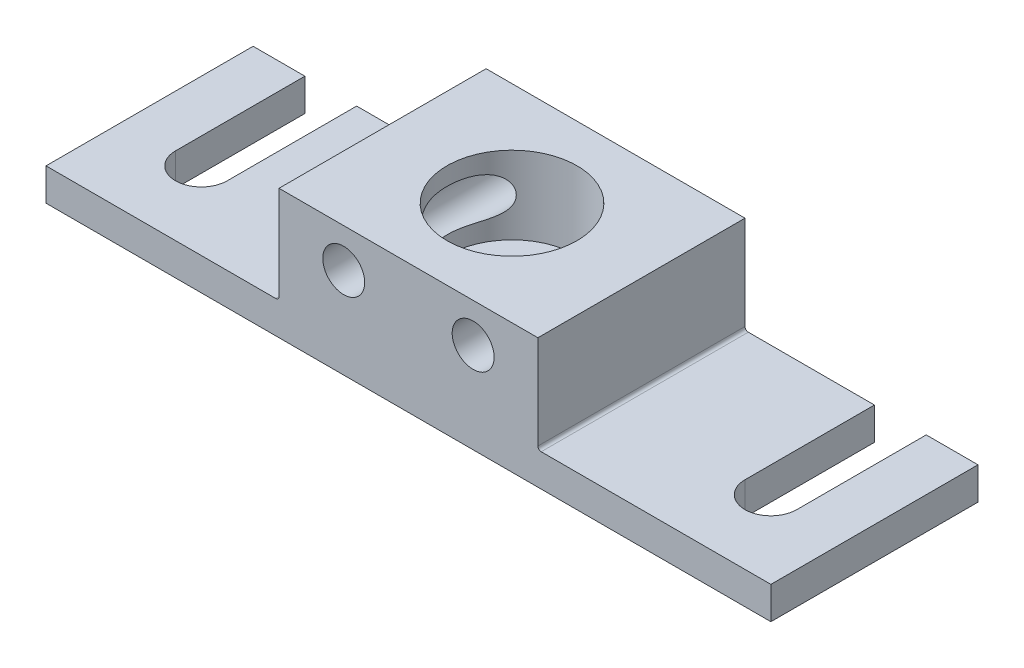
from build123d import *

# Parameters (mm, degrees)
SKETCH1_W           = 28
SKETCH1_H           = 8
BOSS_EXTRUDE1_DEPTH = 1.25
SKETCH2_W           = 10
SKETCH2_H           = 8
BOSS_EXTRUDE2_DEPTH = 3.75
SKETCH3_R           = 2.51
CUT_EXTRUDE1_DEPTH  = 3
SKETCH4_W           = 3
SKETCH4_H           = 2.3
CUT_EXTRUDE2_DEPTH  = 15.866068747
CUT_EXTRUDE4_DEPTH  = 16.035374954
SKETCH7_R           = 0.81
CUT_EXTRUDE5_DEPTH  = 17.881943016
FILLET1_R           = 0.5
FILLET2_R           = 0.127


with BuildPart() as part:
    # Sketch1 → Boss-Extrude1 (new body)
    with BuildSketch(Plane(origin=(0, 0, 0), x_dir=(1, 0, 0), z_dir=(0, 1, 0))):
        Rectangle(SKETCH1_W, SKETCH1_H)
    extrude(amount=BOSS_EXTRUDE1_DEPTH)

    # Sketch2 → Boss-Extrude2 (add)
    with BuildSketch(Plane(origin=(0, 1.25, 0), x_dir=(1, 0, 0), z_dir=(0, 1, 0))):
        Rectangle(SKETCH2_W, SKETCH2_H)
    extrude(amount=BOSS_EXTRUDE2_DEPTH)

    # Sketch3 → Cut-Extrude1 (cut)
    with BuildSketch(Plane(origin=(0, 5, 0), x_dir=(1, 0, 0), z_dir=(0, 1, 0))):
        with Locations(Location((0, 0, 0), (0, 0, 270))):
            Circle(SKETCH3_R)
    extrude(amount=-CUT_EXTRUDE1_DEPTH, mode=Mode.SUBTRACT)

    # Sketch4 → Cut-Extrude2 (cut, through all)
    with BuildSketch(Plane(origin=(0, 2, 0), x_dir=(1, 0, 0), z_dir=(0, 1, 0))):
        Rectangle(SKETCH4_W, SKETCH4_H)
    extrude(amount=-CUT_EXTRUDE2_DEPTH, mode=Mode.SUBTRACT)

    # Sketch6 → Cut-Extrude4 (cut, through all)
    with BuildSketch(Plane(origin=(0, 1.25, 0), x_dir=(1, 0, 0), z_dir=(0, 1, 0))):
        with BuildLine():
            Line((12, 4), (12, -1))
            ThreePointArc((12, -1), (11, -2), (10, -1))
            Line((10, -1), (10, 4))
            Line((10, 4), (12, 4))
        make_face()
        with BuildLine():
            Line((-12, 4), (-12, -1))
            ThreePointArc((-12, -1), (-11, -2), (-10, -1))
            Line((-10, -1), (-10, 4))
            Line((-10, 4), (-12, 4))
        make_face()
    extrude(amount=-CUT_EXTRUDE4_DEPTH, mode=Mode.SUBTRACT)

    # Sketch7 → Cut-Extrude5 (cut, through all)
    with BuildSketch(Plane(origin=(0, 0, -4), x_dir=(-1, 0, 0), z_dir=(0, 0, -1))):
        with Locations((2.5, 3.5)):
            Circle(SKETCH7_R)
    cut_extrude5 = extrude(amount=-CUT_EXTRUDE5_DEPTH, mode=Mode.SUBTRACT)

    # Mirror1: Cut-Extrude5 across plane
    add(cut_extrude5.mirror(Plane.ZY), mode=Mode.SUBTRACT)

    # Fillet1
    fillet1_edges = [part.edges().sort_by_distance(p)[0] for p in [
        (-1.5, 1, -1.15),
        (1.5, 1, -1.15),
        (1.5, 1, 1.15),
        (-1.5, 1, 1.15),
    ]]
    fillet(fillet1_edges, radius=FILLET1_R)

    # Fillet2
    fillet2_edges = [part.edges().sort_by_distance(p)[0] for p in [
        (5, 1.25, 0),
        (-5, 1.25, 0),
    ]]
    fillet(fillet2_edges, radius=FILLET2_R)


solid = part.part
